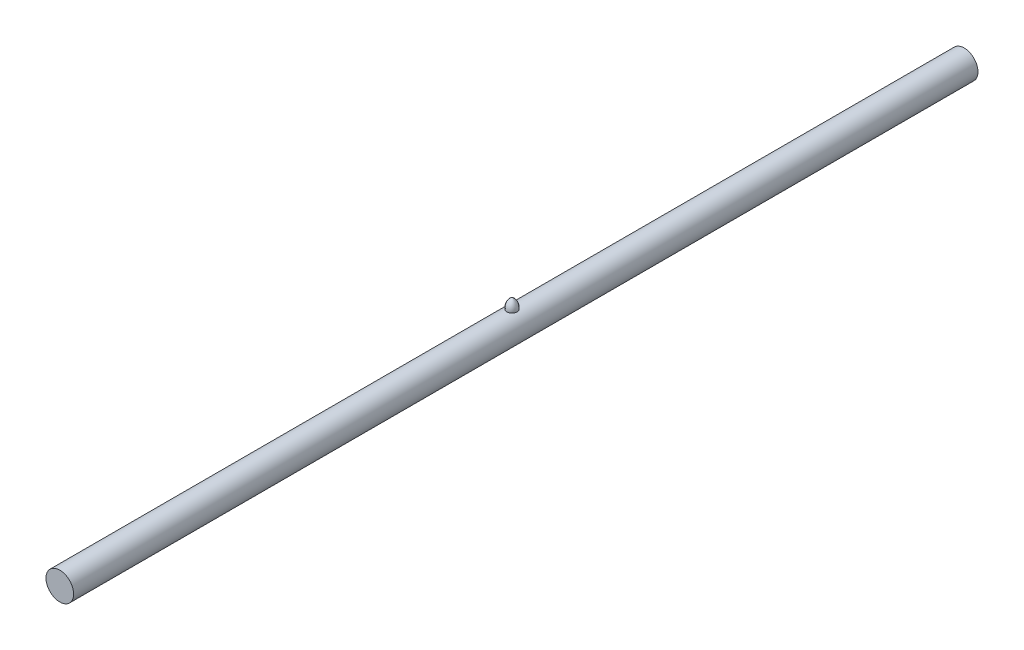
from build123d import *

# Parameters (mm, degrees)
SKETCH1_R           = 3.4925
BOSS_EXTRUDE1_DEPTH = 228.6


with BuildPart() as part:
    # Sketch1 → Boss-Extrude1 (new body)
    with BuildSketch(Plane.XY):
        Circle(SKETCH1_R)
    extrude(amount=BOSS_EXTRUDE1_DEPTH)


with BuildPart() as body_2:
    # Sketch2 → Revolve1 (revolve)
    with BuildSketch(Plane(origin=(0, 0, 0), x_dir=(0, 0, -1), z_dir=(1, 0, 0))):
        with BuildLine():
            Line((-113.03, 3.4925), (-114.3, 3.4925))
            Line((-114.3, 3.4925), (-114.3, 6.0325))
            ThreePointArc((-114.3, 6.0325), (-113.276869351, 4.956565325), (-113.03, 3.4925))
        make_face()
    revolve(axis=Axis((0, 6.0325, 114.3), (0, -1, 0)))


solid = Compound([part.part, body_2.part])
